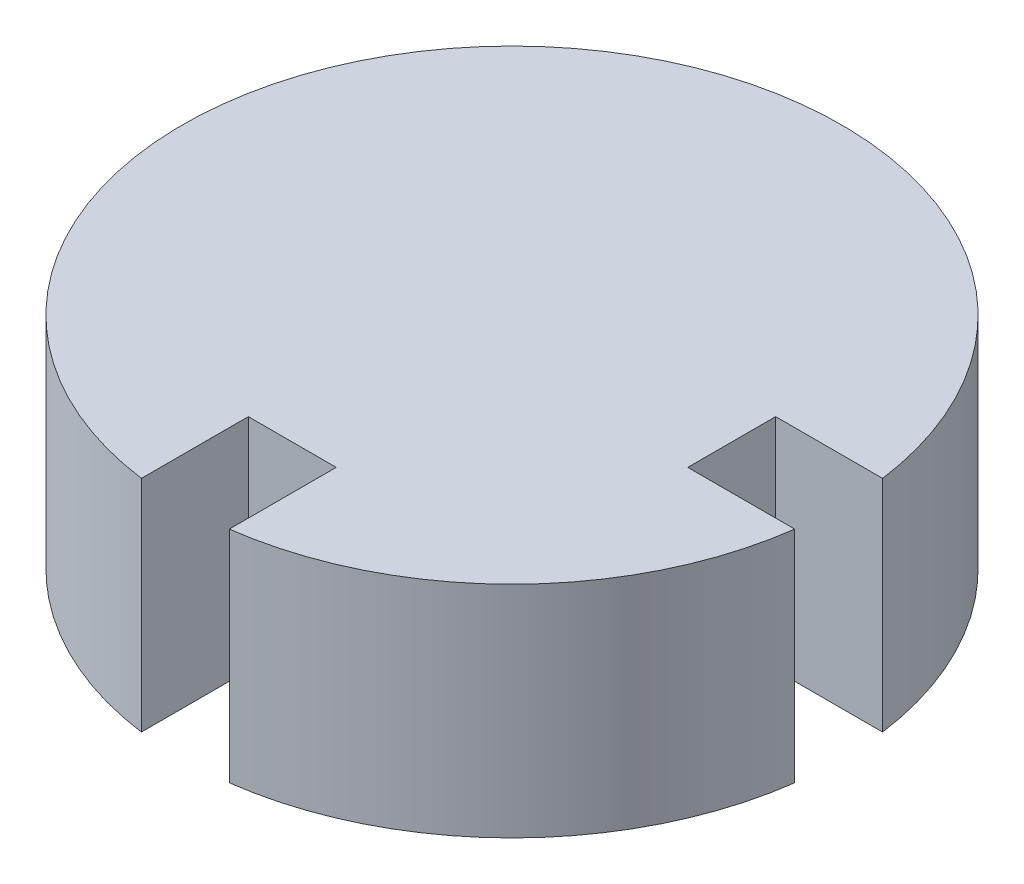
from build123d import *

# Parameters (mm, degrees)
BOSS_EXTRUDE1_DEPTH = 2


with BuildPart() as part:
    # Sketch2 → Boss-Extrude1 (new body)
    with BuildSketch(Plane(origin=(0, 0, 0), x_dir=(1, 0, 0), z_dir=(0, 1, 0))):
        with BuildLine():
            ThreePointArc((2.973213749, 0.4), (-2.121320344, 2.121320344), (-0.4, -2.973213749))
            Line((-0.4, -2.973213749), (-0.4, -2))
            Line((-0.4, -2), (0.4, -2))
            Line((0.4, -2), (0.4, -2.973213749))
            ThreePointArc((0.4, -2.973213749), (2.121320344, -2.121320344), (2.973213749, -0.4))
            Line((2.973213749, -0.4), (2, -0.4))
            Line((2, -0.4), (2, 0.4))
            Line((2, 0.4), (2.973213749, 0.4))
        make_face()
    extrude(amount=BOSS_EXTRUDE1_DEPTH)


solid = part.part
